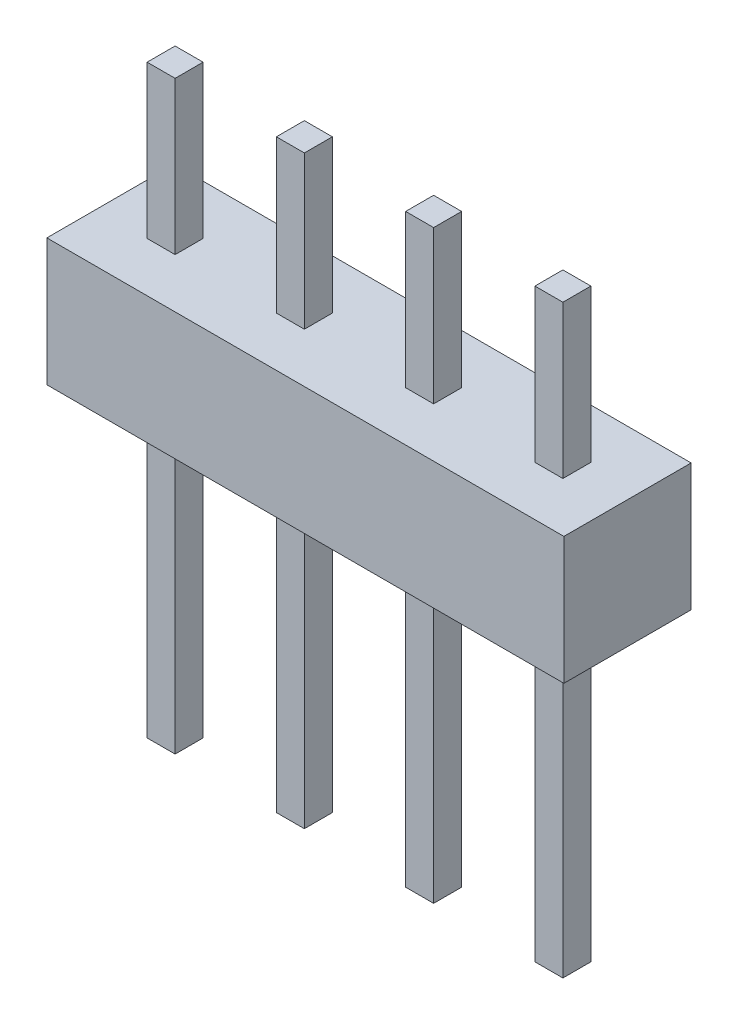
from build123d import *

# Parameters (mm, degrees)
SKETCH1_W             = 10.16
SKETCH1_H             = 2.5
BOSS_EXTRUDE1_DEPTH   = 1.25
SKETCH2_W             = 0.55
SKETCH2_H             = 0.55
BOSS_EXTRUDE2_DEPTH   = 6
BOSS_EXTRUDE2_2_DEPTH = 6
BOSS_EXTRUDE2_3_DEPTH = 6
BOSS_EXTRUDE2_4_DEPTH = 6
SKETCH2_2_W           = 0.55
SKETCH2_2_H           = 0.55
BOSS_EXTRUDE3_DEPTH   = 5.5
BOSS_EXTRUDE3_2_DEPTH = 5.5
BOSS_EXTRUDE3_3_DEPTH = 5.5
BOSS_EXTRUDE3_4_DEPTH = 5.5


with BuildPart() as part:
    # Sketch1 → Boss-Extrude1 (new, symmetric)
    with BuildSketch(Plane.XY):
        with Locations((5.08, 1.25)):
            Rectangle(SKETCH1_W, SKETCH1_H)
    extrude(amount=BOSS_EXTRUDE1_DEPTH, both=True)


with BuildPart() as body_2:
    # Sketch2 → Boss-Extrude2 (new body)
    with BuildSketch(Plane.XZ):
        with Locations((3.81, 0)):
            Rectangle(SKETCH2_W, SKETCH2_H)
    extrude(amount=BOSS_EXTRUDE2_DEPTH)


with BuildPart() as body_3:
    # Sketch2 → Boss-Extrude2 2 (new body)
    with BuildSketch(Plane.XZ):
        with Locations((1.27, 0)):
            Rectangle(SKETCH2_W, SKETCH2_H)
    extrude(amount=BOSS_EXTRUDE2_2_DEPTH)


with BuildPart() as body_4:
    # Sketch2 → Boss-Extrude2 3 (new body)
    with BuildSketch(Plane.XZ):
        with Locations((6.35, 0)):
            Rectangle(SKETCH2_W, SKETCH2_H)
    extrude(amount=BOSS_EXTRUDE2_3_DEPTH)


with BuildPart() as body_5:
    # Sketch2 → Boss-Extrude2 4 (new body)
    with BuildSketch(Plane.XZ):
        with Locations((8.89, 0)):
            Rectangle(SKETCH2_W, SKETCH2_H)
    extrude(amount=BOSS_EXTRUDE2_4_DEPTH)


with BuildPart() as body_6:
    # Sketch2<2> → Boss-Extrude3 (new body)
    with BuildSketch(Plane.XZ):
        with Locations((3.81, 0)):
            Rectangle(SKETCH2_2_W, SKETCH2_2_H)
    extrude(amount=-BOSS_EXTRUDE3_DEPTH)


with BuildPart() as body_7:
    # Sketch2<2> → Boss-Extrude3 2 (new body)
    with BuildSketch(Plane.XZ):
        with Locations((1.27, 0)):
            Rectangle(SKETCH2_2_W, SKETCH2_2_H)
    extrude(amount=-BOSS_EXTRUDE3_2_DEPTH)


with BuildPart() as body_8:
    # Sketch2<2> → Boss-Extrude3 3 (new body)
    with BuildSketch(Plane.XZ):
        with Locations((6.35, 0)):
            Rectangle(SKETCH2_2_W, SKETCH2_2_H)
    extrude(amount=-BOSS_EXTRUDE3_3_DEPTH)


with BuildPart() as body_9:
    # Sketch2<2> → Boss-Extrude3 4 (new body)
    with BuildSketch(Plane.XZ):
        with Locations((8.89, 0)):
            Rectangle(SKETCH2_2_W, SKETCH2_2_H)
    extrude(amount=-BOSS_EXTRUDE3_4_DEPTH)


solid = Compound([part.part, body_2.part, body_3.part, body_4.part, body_5.part, body_6.part, body_7.part, body_8.part, body_9.part])
